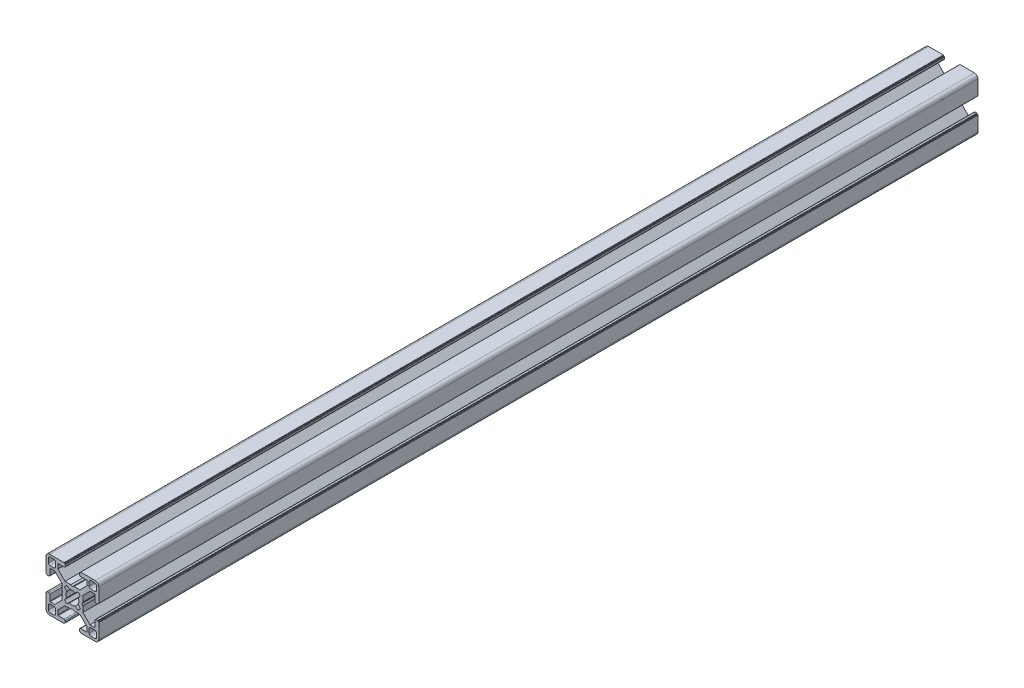
from build123d import *

# Parameters (mm, degrees)
BASE_EXTRUDE_DEPTH = 500


with BuildPart() as part:
    # Sketch1 → Base-Extrude (new body)
    with BuildSketch(Plane.XY):
        with BuildLine():
            Line((6.00446543, 0.899999619), (5.484852164, 0))
            Line((5.484852164, 0), (6.00446543, -0.899999619))
            Line((6.00446543, -0.899999619), (6.00446543, -4.204465866))
            Line((6.00446543, -4.204465866), (10.049999564, -8.25))
            Line((10.049999564, -8.25), (12.59999928, -8.25))
            ThreePointArc((12.59999928, -8.25), (12.741420837, -8.191421273), (12.799999564, -8.049999716))
            Line((12.799999564, -8.049999716), (12.799999564, -4.649999613))
            ThreePointArc((12.799999564, -4.649999613), (12.975735606, -4.225735278), (13.39999994, -4.049999237))
            Line((13.39999994, -4.049999237), (14.300000043, -4.049999237))
            ThreePointArc((14.300000043, -4.049999237), (14.4414216, -4.108577964), (14.500000327, -4.249999521))
            Line((14.500000327, -4.249999521), (14.500000327, -4.349998953))
            ThreePointArc((14.500000327, -4.349998953), (14.558579054, -4.49142051), (14.700000611, -4.549999237))
            Line((14.700000611, -4.549999237), (14.799999716, -4.549999237))
            ThreePointArc((14.799999716, -4.549999237), (14.941421273, -4.608577964), (15, -4.749999521))
            Line((15, -4.749999521), (15, -13.000000346))
            ThreePointArc((15, -13.000000346), (14.414213664, -14.414213664), (13.000000346, -15))
            Line((13.000000346, -15), (4.749999945, -15))
            ThreePointArc((4.749999945, -15), (4.60857832, -14.941421245), (4.549999564, -14.799999619))
            Line((4.549999564, -14.799999619), (4.549999564, -14.69999942))
            ThreePointArc((4.549999564, -14.69999942), (4.49142109, -14.558578474), (4.350000144, -14.5))
            Line((4.350000144, -14.5), (4.250000374, -14.5))
            ThreePointArc((4.250000374, -14.5), (4.108578753, -14.441421247), (4.05, -14.299999626))
            Line((4.05, -14.299999626), (4.05, -13.399999434))
            ThreePointArc((4.05, -13.399999434), (4.225735989, -12.975735226), (4.650000197, -12.799999237))
            Line((4.650000197, -12.799999237), (8.049999924, -12.799999237))
            ThreePointArc((8.049999924, -12.799999237), (8.191421565, -12.741420475), (8.250000327, -12.599998834))
            Line((8.250000327, -12.599998834), (8.250000327, -10.049999237))
            Line((8.250000327, -10.049999237), (4.204466193, -6))
            Line((4.204466193, -6), (0.899999946, -6))
            Line((0.899999946, -6), (0, -5.484851837))
            Line((0, -5.484851837), (-0.899999946, -6))
            Line((-0.899999946, -6), (-4.204466193, -6))
            Line((-4.204466193, -6), (-8.250000327, -10.049999237))
            Line((-8.250000327, -10.049999237), (-8.250000327, -12.599998834))
            ThreePointArc((-8.250000327, -12.599998834), (-8.191421565, -12.741420475), (-8.049999924, -12.799999237))
            Line((-8.049999924, -12.799999237), (-4.650000197, -12.799999237))
            ThreePointArc((-4.650000197, -12.799999237), (-4.225735989, -12.975735226), (-4.05, -13.399999434))
            Line((-4.05, -13.399999434), (-4.05, -14.299999626))
            ThreePointArc((-4.05, -14.299999626), (-4.108578753, -14.441421247), (-4.250000374, -14.5))
            Line((-4.250000374, -14.5), (-4.350000144, -14.5))
            ThreePointArc((-4.350000144, -14.5), (-4.49142109, -14.558578474), (-4.549999564, -14.69999942))
            Line((-4.549999564, -14.69999942), (-4.549999564, -14.799999619))
            ThreePointArc((-4.549999564, -14.799999619), (-4.60857832, -14.941421245), (-4.749999945, -15))
            Line((-4.749999945, -15), (-13.000000346, -15))
            ThreePointArc((-13.000000346, -15), (-14.414213664, -14.414213664), (-15, -13.000000346))
            Line((-15, -13.000000346), (-15, -4.749999521))
            ThreePointArc((-15, -4.749999521), (-14.941421273, -4.608577964), (-14.799999716, -4.549999237))
            Line((-14.799999716, -4.549999237), (-14.700000611, -4.549999237))
            ThreePointArc((-14.700000611, -4.549999237), (-14.558579054, -4.49142051), (-14.500000327, -4.349998953))
            Line((-14.500000327, -4.349998953), (-14.500000327, -4.249999521))
            ThreePointArc((-14.500000327, -4.249999521), (-14.4414216, -4.108577964), (-14.300000043, -4.049999237))
            Line((-14.300000043, -4.049999237), (-13.39999994, -4.049999237))
            ThreePointArc((-13.39999994, -4.049999237), (-12.975735606, -4.225735278), (-12.799999564, -4.649999613))
            Line((-12.799999564, -4.649999613), (-12.799999564, -8.049999716))
            ThreePointArc((-12.799999564, -8.049999716), (-12.741420837, -8.191421273), (-12.59999928, -8.25))
            Line((-12.59999928, -8.25), (-10.049999564, -8.25))
            Line((-10.049999564, -8.25), (-6.00446543, -4.204465866))
            Line((-6.00446543, -4.204465866), (-6.00446543, -0.899999619))
            Line((-6.00446543, -0.899999619), (-5.484852164, 0))
            Line((-5.484852164, 0), (-6.00446543, 0.899999619))
            Line((-6.00446543, 0.899999619), (-6.00446543, 4.204465866))
            Line((-6.00446543, 4.204465866), (-10.049999564, 8.25))
            Line((-10.049999564, 8.25), (-12.59999928, 8.25))
            ThreePointArc((-12.59999928, 8.25), (-12.741420837, 8.191421273), (-12.799999564, 8.049999716))
            Line((-12.799999564, 8.049999716), (-12.799999564, 4.649999613))
            ThreePointArc((-12.799999564, 4.649999613), (-12.975735606, 4.225735278), (-13.39999994, 4.049999237))
            Line((-13.39999994, 4.049999237), (-14.300000043, 4.049999237))
            ThreePointArc((-14.300000043, 4.049999237), (-14.4414216, 4.108577964), (-14.500000327, 4.249999521))
            Line((-14.500000327, 4.249999521), (-14.500000327, 4.349998953))
            ThreePointArc((-14.500000327, 4.349998953), (-14.558579054, 4.49142051), (-14.700000611, 4.549999237))
            Line((-14.700000611, 4.549999237), (-14.799999716, 4.549999237))
            ThreePointArc((-14.799999716, 4.549999237), (-14.941421273, 4.608577964), (-15, 4.749999521))
            Line((-15, 4.749999521), (-15, 13.000000346))
            ThreePointArc((-15, 13.000000346), (-14.414213664, 14.414213664), (-13.000000346, 15))
            Line((-13.000000346, 15), (-4.749999945, 15))
            ThreePointArc((-4.749999945, 15), (-4.60857832, 14.941421245), (-4.549999564, 14.799999619))
            Line((-4.549999564, 14.799999619), (-4.549999564, 14.69999942))
            ThreePointArc((-4.549999564, 14.69999942), (-4.49142109, 14.558578474), (-4.350000144, 14.5))
            Line((-4.350000144, 14.5), (-4.250000374, 14.5))
            ThreePointArc((-4.250000374, 14.5), (-4.108578753, 14.441421247), (-4.05, 14.299999626))
            Line((-4.05, 14.299999626), (-4.05, 13.399999434))
            ThreePointArc((-4.05, 13.399999434), (-4.225735989, 12.975735226), (-4.650000197, 12.799999237))
            Line((-4.650000197, 12.799999237), (-8.049999924, 12.799999237))
            ThreePointArc((-8.049999924, 12.799999237), (-8.191421565, 12.741420475), (-8.250000327, 12.599998834))
            Line((-8.250000327, 12.599998834), (-8.250000327, 10.049999237))
            Line((-8.250000327, 10.049999237), (-4.204466193, 6))
            Line((-4.204466193, 6), (-0.899999946, 6))
            Line((-0.899999946, 6), (0, 5.484851837))
            Line((0, 5.484851837), (0.899999946, 6))
            Line((0.899999946, 6), (4.204466193, 6))
            Line((4.204466193, 6), (8.250000327, 10.049999237))
            Line((8.250000327, 10.049999237), (8.250000327, 12.599998834))
            ThreePointArc((8.250000327, 12.599998834), (8.191421565, 12.741420475), (8.049999924, 12.799999237))
            Line((8.049999924, 12.799999237), (4.650000197, 12.799999237))
            ThreePointArc((4.650000197, 12.799999237), (4.225735989, 12.975735226), (4.05, 13.399999434))
            Line((4.05, 13.399999434), (4.05, 14.299999626))
            ThreePointArc((4.05, 14.299999626), (4.108578753, 14.441421247), (4.250000374, 14.5))
            Line((4.250000374, 14.5), (4.350000144, 14.5))
            ThreePointArc((4.350000144, 14.5), (4.49142109, 14.558578474), (4.549999564, 14.69999942))
            Line((4.549999564, 14.69999942), (4.549999564, 14.799999619))
            ThreePointArc((4.549999564, 14.799999619), (4.60857832, 14.941421245), (4.749999945, 15))
            Line((4.749999945, 15), (13.000000346, 15))
            ThreePointArc((13.000000346, 15), (14.414213664, 14.414213664), (15, 13.000000346))
            Line((15, 13.000000346), (15, 4.749999521))
            ThreePointArc((15, 4.749999521), (14.941421273, 4.608577964), (14.799999716, 4.549999237))
            Line((14.799999716, 4.549999237), (14.700000611, 4.549999237))
            ThreePointArc((14.700000611, 4.549999237), (14.558579054, 4.49142051), (14.500000327, 4.349998953))
            Line((14.500000327, 4.349998953), (14.500000327, 4.249999521))
            ThreePointArc((14.500000327, 4.249999521), (14.4414216, 4.108577964), (14.300000043, 4.049999237))
            Line((14.300000043, 4.049999237), (13.39999994, 4.049999237))
            ThreePointArc((13.39999994, 4.049999237), (12.975735606, 4.225735278), (12.799999564, 4.649999613))
            Line((12.799999564, 4.649999613), (12.799999564, 8.049999716))
            ThreePointArc((12.799999564, 8.049999716), (12.741420837, 8.191421273), (12.59999928, 8.25))
            Line((12.59999928, 8.25), (10.049999564, 8.25))
            Line((10.049999564, 8.25), (6.00446543, 4.204465866))
            Line((6.00446543, 4.204465866), (6.00446543, 0.899999619))
        make_face()
        with BuildLine():
            Line((13.70000109, 12.700000408), (13.70000109, 10.499999626))
            ThreePointArc((13.70000109, 10.499999626), (13.407107874, 9.792892851), (12.7000011, 9.499999635))
            Line((12.7000011, 9.499999635), (10.500000318, 9.499999635))
            ThreePointArc((10.500000318, 9.499999635), (9.792893543, 9.792892851), (9.500000327, 10.499999626))
            Line((9.500000327, 10.499999626), (9.500000327, 12.700000408))
            ThreePointArc((9.500000327, 12.700000408), (9.792893543, 13.407107182), (10.500000318, 13.700000398))
            Line((10.500000318, 13.700000398), (12.7000011, 13.700000398))
            ThreePointArc((12.7000011, 13.700000398), (13.407107874, 13.407107182), (13.70000109, 12.700000408))
        make_face(mode=Mode.SUBTRACT)
        with BuildLine():
            Line((3.135929412, 4.518400903), (1.600129524, 3.280561767))
            ThreePointArc((1.600129524, 3.280561767), (0, 3.65), (-1.600129524, 3.280561767))
            Line((-1.600129524, 3.280561767), (-3.135929412, 4.518400903))
            ThreePointArc((-3.135929412, 4.518400903), (-3.881002259, 3.897155561), (-4.505336892, 3.154669473))
            Line((-4.505336892, 3.154669473), (-3.280561732, 1.600129597))
            ThreePointArc((-3.280561732, 1.600129597), (-3.65, 0), (-3.280561732, -1.600129597))
            Line((-3.280561732, -1.600129597), (-4.505336892, -3.154669473))
            ThreePointArc((-4.505336892, -3.154669473), (-3.881002259, -3.897155561), (-3.135929412, -4.518400903))
            Line((-3.135929412, -4.518400903), (-1.600129524, -3.280561767))
            ThreePointArc((-1.600129524, -3.280561767), (0, -3.65), (1.600129524, -3.280561767))
            Line((1.600129524, -3.280561767), (3.135929412, -4.518400903))
            ThreePointArc((3.135929412, -4.518400903), (3.881002259, -3.897155561), (4.505336892, -3.154669473))
            Line((4.505336892, -3.154669473), (3.280561732, -1.600129597))
            ThreePointArc((3.280561732, -1.600129597), (3.65, 0), (3.280561732, 1.600129597))
            Line((3.280561732, 1.600129597), (4.505336892, 3.154669473))
            ThreePointArc((4.505336892, 3.154669473), (3.881002259, 3.897155561), (3.135929412, 4.518400903))
        make_face(mode=Mode.SUBTRACT)
        with BuildLine():
            Line((-13.70000109, -12.700000408), (-13.70000109, -10.499999626))
            ThreePointArc((-13.70000109, -10.499999626), (-13.407107874, -9.792892851), (-12.7000011, -9.499999635))
            Line((-12.7000011, -9.499999635), (-10.500000318, -9.499999635))
            ThreePointArc((-10.500000318, -9.499999635), (-9.792893543, -9.792892851), (-9.500000327, -10.499999626))
            Line((-9.500000327, -10.499999626), (-9.500000327, -12.700000408))
            ThreePointArc((-9.500000327, -12.700000408), (-9.792893543, -13.407107182), (-10.500000318, -13.700000398))
            Line((-10.500000318, -13.700000398), (-12.7000011, -13.700000398))
            ThreePointArc((-12.7000011, -13.700000398), (-13.407107874, -13.407107182), (-13.70000109, -12.700000408))
        make_face(mode=Mode.SUBTRACT)
        with BuildLine():
            Line((10.500000318, -13.700000398), (12.7000011, -13.700000398))
            ThreePointArc((12.7000011, -13.700000398), (13.407107874, -13.407107182), (13.70000109, -12.700000408))
            Line((13.70000109, -12.700000408), (13.70000109, -10.499999626))
            ThreePointArc((13.70000109, -10.499999626), (13.407107874, -9.792892851), (12.7000011, -9.499999635))
            Line((12.7000011, -9.499999635), (10.500000318, -9.499999635))
            ThreePointArc((10.500000318, -9.499999635), (9.792893543, -9.792892851), (9.500000327, -10.499999626))
            Line((9.500000327, -10.499999626), (9.500000327, -12.700000408))
            ThreePointArc((9.500000327, -12.700000408), (9.792893543, -13.407107182), (10.500000318, -13.700000398))
        make_face(mode=Mode.SUBTRACT)
        with BuildLine():
            Line((-10.500000318, 13.700000398), (-12.7000011, 13.700000398))
            ThreePointArc((-12.7000011, 13.700000398), (-13.407107874, 13.407107182), (-13.70000109, 12.700000408))
            Line((-13.70000109, 12.700000408), (-13.70000109, 10.499999626))
            ThreePointArc((-13.70000109, 10.499999626), (-13.407107874, 9.792892851), (-12.7000011, 9.499999635))
            Line((-12.7000011, 9.499999635), (-10.500000318, 9.499999635))
            ThreePointArc((-10.500000318, 9.499999635), (-9.792893543, 9.792892851), (-9.500000327, 10.499999626))
            Line((-9.500000327, 10.499999626), (-9.500000327, 12.700000408))
            ThreePointArc((-9.500000327, 12.700000408), (-9.792893543, 13.407107182), (-10.500000318, 13.700000398))
        make_face(mode=Mode.SUBTRACT)
    extrude(amount=-BASE_EXTRUDE_DEPTH)


solid = part.part
